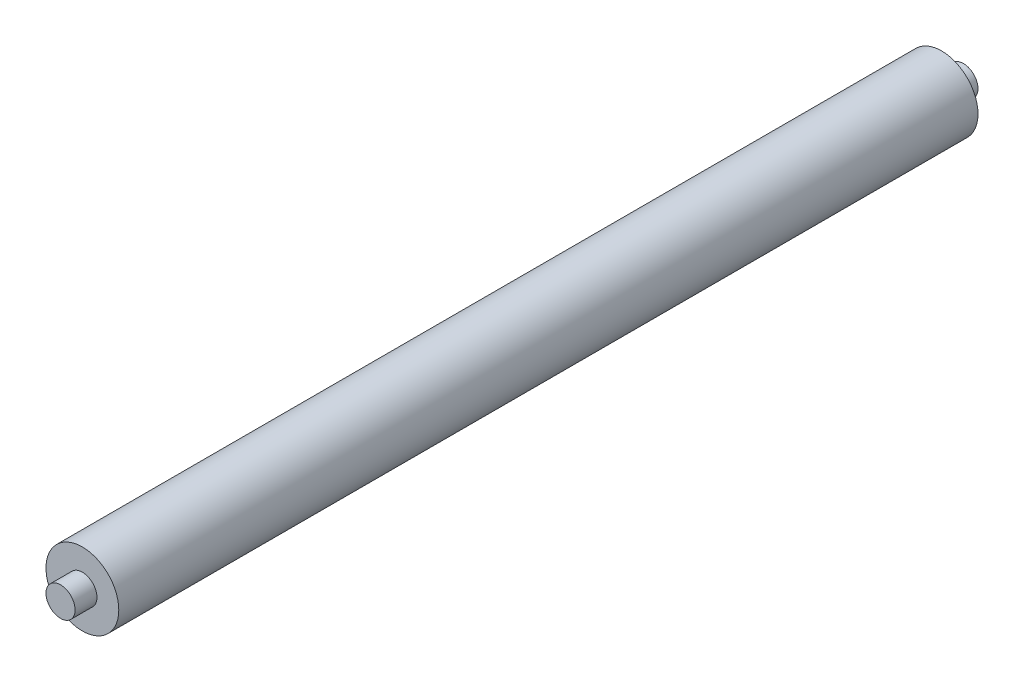
from build123d import *

# Parameters (mm, degrees)
SKETCH2_R                = 25
BOSS_EXTRUDE1_DEPTH      = 295
BOSS_EXTRUDE2_DEPTH      = 310
BOSS_EXTRUDE2_DEPTH_BACK = 310
SKETCH2_3_R              = 10


with BuildPart() as part:
    # Sketch2 → Boss-Extrude1 (new, symmetric)
    with BuildSketch(Plane.XY):
        Circle(SKETCH2_R)
    extrude(amount=BOSS_EXTRUDE1_DEPTH, both=True)

    # Sketch2<3> → Boss-Extrude2 (add, two sides: drawn at the far end of the back side and taken through both)
    with BuildSketch(Plane.XY.offset(-BOSS_EXTRUDE2_DEPTH_BACK)):
        Circle(SKETCH2_3_R)
    extrude(amount=BOSS_EXTRUDE2_DEPTH + BOSS_EXTRUDE2_DEPTH_BACK)


solid = part.part
